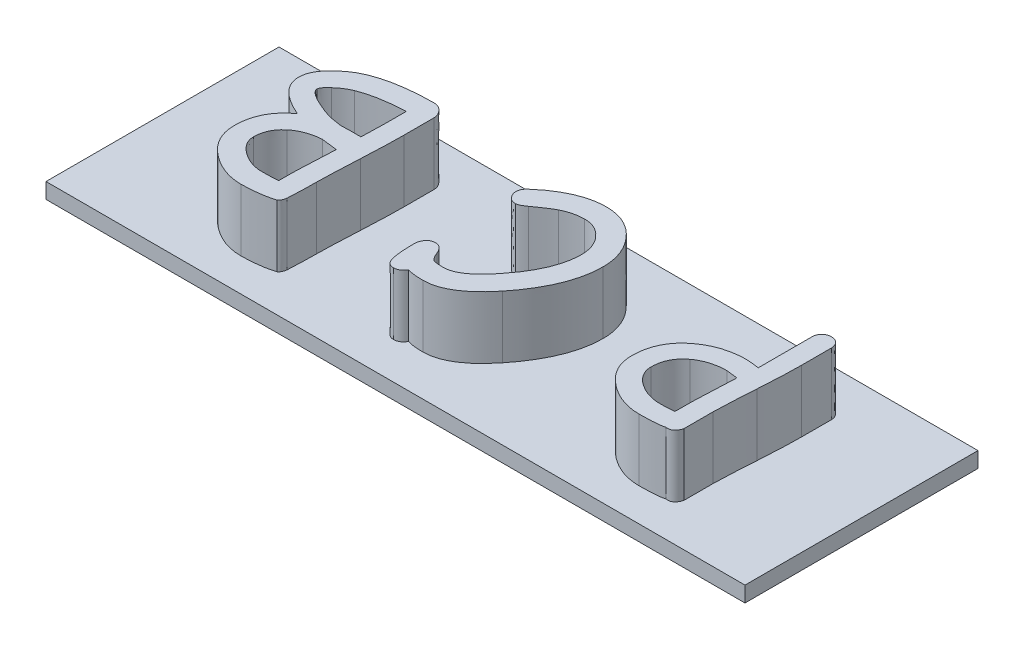
from build123d import *

# Parameters (mm, degrees)
SKETCH1_W           = 114.3
SKETCH1_H           = 38.1
BOSS_EXTRUDE1_DEPTH = 2.54
BOSS_EXTRUDE2_DEPTH = 10.16


with BuildPart() as part:
    # Sketch1 → Boss-Extrude1 (new body)
    with BuildSketch(Plane(origin=(0, 0, 0), x_dir=(1, 0, 0), z_dir=(0, 1, 0))):
        with Locations((57.15, 19.05)):
            Rectangle(SKETCH1_W, SKETCH1_H)
    extrude(amount=BOSS_EXTRUDE1_DEPTH)

    # Sketch2 → Boss-Extrude2 (add)
    # profile 1 of 3: a face of its own
    with BuildSketch(Plane(origin=(0, 2.54, 0), x_dir=(1, 0, 0), z_dir=(0, 1, 0))):
        with BuildLine():
            add(Edge.make_bspline(
                [(92.71, 21.9075), (92.812573831, 21.903302607), (93.064457549, 21.892995349), (93.511163416, 21.850071997), (94.096176455, 21.778624785), (94.532369983, 21.721068917), (94.77375, 21.68921875)],
                knots=[0, 0, 0, 0, 0.593305599, 1.456941008, 2.592726431, 4, 4, 4, 4], degree=3))
            add(Edge.make_bspline(
                [(94.77375, 21.68921875), (94.77375, 21.919075521), (94.77375, 22.416822917), (94.77375, 23.222148438), (94.77375, 24.144882812), (94.77375, 25.186679687), (94.77375, 26.345885417), (94.77375, 27.6225), (94.77375, 29.016523438), (94.77375, 29.985559896), (94.77375, 30.489921875)],
                knots=[0, 0, 0, 0, 0.626832018, 1.357384442, 2.196166855, 3.143179256, 4.198421646, 5.357384442, 6.624577227, 8, 8, 8, 8], degree=3))
            add(Edge.make_bspline(
                [(94.77375, 30.489921875), (94.779741605, 30.596279971), (94.791545965, 30.805821358), (94.876365048, 31.105538766), (95.02132653, 31.378231569), (95.217431277, 31.616997773), (95.455809639, 31.816971191), (95.728442912, 31.964590533), (96.032104414, 32.050092948), (96.243312646, 32.061609989), (96.351328125, 32.0675)],
                knots=[0, 0, 0, 0, 1.025920981, 2.021218054, 2.977888513, 3.987415727, 4.984630399, 5.962890527, 6.9581876, 8, 8, 8, 8], degree=3))
            add(Edge.make_bspline(
                [(96.351328125, 32.0675), (96.462632522, 32.061677106), (96.678716152, 32.050372681), (96.987744688, 31.965663102), (97.263880919, 31.815844739), (97.503123899, 31.613486258), (97.702968147, 31.372581245), (97.843764065, 31.097907127), (97.932324932, 30.797944901), (97.943164423, 30.588121667), (97.94875, 30.48)],
                knots=[0, 0, 0, 0, 1.062403609, 2.062524345, 3.030581152, 4.039640583, 5.038638359, 5.999323576, 6.969053775, 8, 8, 8, 8], degree=3))
            Line((97.94875, 30.48), (97.94875, 25.563710938))
            add(Edge.make_bspline(
                [(97.94875, 25.563710938), (97.947783553, 25.348727469), (97.945753812, 24.897217149), (97.928273239, 24.187847275), (97.909941114, 23.41550699), (97.881017207, 22.580240931), (97.833390457, 21.684232222), (97.783746648, 20.725129876), (97.732015848, 19.702807017), (97.685164864, 19.000331621), (97.661015625, 18.638242188)],
                knots=[0, 0, 0, 0, 0.744252416, 1.563085986, 2.456455997, 3.418843846, 4.456321737, 5.562699762, 6.74369883, 8, 8, 8, 8], degree=3))
            add(Edge.make_bspline(
                [(97.661015625, 18.638242188), (97.635700823, 18.249666229), (97.587015874, 17.502364297), (97.524861035, 16.422296424), (97.461117508, 15.428863267), (97.420532796, 14.520618765), (97.377234296, 13.698989472), (97.350818835, 12.962913725), (97.321113031, 12.31160321), (97.316087631, 11.906277177), (97.31375, 11.717734375)],
                knots=[0, 0, 0, 0, 1.348601287, 2.593604475, 3.746796013, 4.796117256, 5.742194519, 6.596220126, 7.347013097, 8, 8, 8, 8], degree=3))
            Line((97.31375, 11.717734375), (97.31375, 9.410898438))
            add(Edge.make_bspline(
                [(97.31375, 9.410898438), (97.31375, 9.152929688), (97.31375, 8.676679688), (97.31375, 8.018528646), (97.31375, 7.474479167), (97.31375, 7.148710938), (97.31375, 7.00484375)],
                knots=[0, 0, 0, 0, 1.286597938, 2.375257732, 3.282474227, 4, 4, 4, 4], degree=3))
            add(Edge.make_bspline(
                [(97.31375, 7.00484375), (97.278674651, 6.88969175), (97.212539869, 6.672571956), (97.072950348, 6.378332595), (96.902936303, 6.137171168), (96.708061184, 5.941715928), (96.478159361, 5.803348766), (96.219357468, 5.725971133), (95.934534737, 5.693540165), (95.739374789, 5.717374397), (95.636953125, 5.729882813)],
                knots=[0, 0, 0, 0, 1.225321951, 2.310351965, 3.301321782, 4.218671067, 5.102777083, 6.003264188, 6.95209541, 8, 8, 8, 8], degree=3))
            add(Edge.make_bspline(
                [(95.636953125, 5.729882813), (95.536304333, 5.704147637), (95.316559817, 5.647960537), (94.954292598, 5.578281556), (94.53277001, 5.529102638), (94.057024092, 5.47555926), (93.52371498, 5.446166137), (92.933619002, 5.412631581), (92.283402632, 5.400665397), (91.83025759, 5.398585415), (91.593789062, 5.3975)],
                knots=[0, 0, 0, 0, 0.613005048, 1.338361789, 2.174755912, 3.116646051, 4.163043477, 5.325786659, 6.604492527, 8, 8, 8, 8], degree=3))
            add(Edge.make_bspline(
                [(91.593789062, 5.3975), (91.333908942, 5.404965329), (90.81743668, 5.419801537), (90.049935572, 5.514781163), (89.295900264, 5.678990368), (88.556342835, 5.916333437), (87.822401331, 6.20752647), (87.104113633, 6.57272327), (86.395900422, 6.998315616), (85.947386542, 7.328572464), (85.720039062, 7.495976563)],
                knots=[0, 0, 0, 0, 0.981821635, 1.951221358, 2.916849201, 3.892929606, 4.882512172, 5.89671537, 6.933864748, 8, 8, 8, 8], degree=3))
            add(Edge.make_bspline(
                [(85.720039062, 7.495976563), (85.481111422, 7.68811438), (85.01420206, 8.063587665), (84.400425493, 8.690342374), (83.87506742, 9.344196187), (83.454228379, 10.033292306), (83.113551386, 10.745800339), (82.88300534, 11.494895322), (82.731137851, 12.27049905), (82.716252611, 12.800149523), (82.70875, 13.067109375)],
                knots=[0, 0, 0, 0, 1.11821384, 2.185199293, 3.19473146, 4.172962323, 5.126088507, 6.069070675, 7.026753238, 8, 8, 8, 8], degree=3))
            add(Edge.make_bspline(
                [(82.70875, 13.067109375), (82.717872611, 13.405023964), (82.735763235, 14.067718294), (82.888182751, 15.034570075), (83.13489241, 15.949191883), (83.485723933, 16.810027136), (83.93401862, 17.61894464), (84.485282666, 18.372112614), (85.13397576, 19.074350111), (85.630661191, 19.485445795), (85.88375, 19.694921875)],
                knots=[0, 0, 0, 0, 1.062640722, 2.083976256, 3.070982761, 4.037131393, 5.00131682, 5.973289506, 6.967278458, 8, 8, 8, 8], degree=3))
            add(Edge.make_bspline(
                [(85.88375, 19.694921875), (86.123510589, 19.873518068), (86.600007791, 20.228457914), (87.372357216, 20.671789023), (88.173043279, 21.058212957), (89.011723132, 21.370452631), (89.887527655, 21.608096057), (90.796143077, 21.781557167), (91.741727059, 21.88826706), (92.383952328, 21.90102367), (92.71, 21.9075)],
                knots=[0, 0, 0, 0, 0.980516566, 1.948666387, 2.917333375, 3.896286309, 4.881224669, 5.89250628, 6.930058574, 8, 8, 8, 8], degree=3))
        make_face()
        with BuildLine():
            add(Edge.make_bspline(
                [(91.85671875, 8.5725), (92.088245948, 8.574690709), (92.523333554, 8.578807506), (93.135730482, 8.601261313), (93.665220145, 8.645206741), (93.990041126, 8.68721375), (94.13875, 8.706445313)],
                knots=[0, 0, 0, 0, 1.214443937, 2.282191934, 3.213556643, 4, 4, 4, 4], degree=3))
            Line((94.13875, 8.706445313), (94.168515625, 11.80703125))
            Line((94.168515625, 11.80703125), (94.45625, 18.51421875))
            Line((94.45625, 18.51421875), (92.640546875, 18.7325))
            add(Edge.make_bspline(
                [(92.640546875, 18.7325), (92.413886751, 18.726897368), (91.967928227, 18.715874073), (91.312100111, 18.653959769), (90.686313754, 18.536816815), (90.085746291, 18.385794957), (89.513780968, 18.180494022), (88.969091871, 17.931454246), (88.446309089, 17.646674302), (88.127088759, 17.414816103), (87.96734375, 17.298789062)],
                knots=[0, 0, 0, 0, 1.093413471, 2.151313819, 3.172871577, 4.161389512, 5.135157218, 6.098878027, 7.048635948, 8, 8, 8, 8], degree=3))
            add(Edge.make_bspline(
                [(87.96734375, 17.298789062), (87.802007344, 17.166882002), (87.475601999, 16.906472509), (87.05050665, 16.458487557), (86.688173459, 15.977967315), (86.39317713, 15.462915184), (86.163880252, 14.912854232), (85.999438768, 14.330181776), (85.904926057, 13.71179476), (85.890931455, 13.289020639), (85.88375, 13.072070313)],
                knots=[0, 0, 0, 0, 1.035286189, 2.043850807, 3.016094581, 3.977816293, 4.94382854, 5.928750352, 6.937119695, 8, 8, 8, 8], degree=3))
            add(Edge.make_bspline(
                [(85.88375, 13.072070313), (85.888898058, 12.916121842), (85.899073516, 12.607879929), (85.998125081, 12.155040427), (86.157309711, 11.721196819), (86.381657383, 11.305263204), (86.658343337, 10.898763067), (87.012476759, 10.519542564), (87.418271721, 10.14906943), (87.725064935, 9.930314458), (87.883007812, 9.817695313)],
                knots=[0, 0, 0, 0, 0.938388107, 1.854782823, 2.778298207, 3.714197428, 4.695245811, 5.731976383, 6.832379074, 8, 8, 8, 8], degree=3))
            add(Edge.make_bspline(
                [(87.883007812, 9.817695313), (88.0369858, 9.717671517), (88.341784084, 9.519675156), (88.819326108, 9.268913027), (89.30232337, 9.052297167), (89.796104844, 8.880494207), (90.296845959, 8.737273937), (90.81084117, 8.647211347), (91.330918521, 8.58345921), (91.681235867, 8.576157575), (91.85671875, 8.5725)],
                knots=[0, 0, 0, 0, 1.041958917, 2.062549938, 3.058709131, 4.044550683, 5.028557611, 6.011892478, 7.004106296, 8, 8, 8, 8], degree=3))
        make_face(mode=Mode.SUBTRACT)
    # profile 2 of 3: a face of its own
    with BuildSketch(Plane(origin=(0, 2.54, 0), x_dir=(1, 0, 0), z_dir=(0, 1, 0))):
        with BuildLine():
            add(Edge.make_bspline(
                [(50.666054688, 13.0175), (50.750763032, 13.013937537), (50.915793523, 13.006997075), (51.156698876, 12.944528609), (51.379902532, 12.839828655), (51.586716128, 12.693727369), (51.771164673, 12.503778987), (51.945839952, 12.281222148), (52.100632154, 12.013297871), (52.184610331, 11.816311308), (52.22875, 11.712773438)],
                knots=[0, 0, 0, 0, 0.933712839, 1.819078009, 2.725453192, 3.642061967, 4.597116546, 5.637643057, 6.758324407, 8, 8, 8, 8], degree=3))
            add(Edge.make_bspline(
                [(52.22875, 11.712773438), (52.303900338, 11.544407987), (52.440970542, 11.237318398), (52.660883647, 10.840488048), (52.868783866, 10.541908568), (53.03142515, 10.410428564), (53.101875, 10.353476563)],
                knots=[0, 0, 0, 0, 1.353791631, 2.469243637, 3.336936149, 4, 4, 4, 4], degree=3))
            add(Edge.make_bspline(
                [(53.101875, 10.353476563), (53.182144213, 10.322472417), (53.37996356, 10.246064294), (53.759390611, 10.203558063), (54.259879147, 10.159699977), (54.637862041, 10.15989276), (54.848125, 10.16)],
                knots=[0, 0, 0, 0, 0.582507722, 1.435560332, 2.573462759, 4, 4, 4, 4], degree=3))
            add(Edge.make_bspline(
                [(54.848125, 10.16), (55.05597176, 10.172370005), (55.483457051, 10.197811804), (56.125557872, 10.384822521), (56.782585739, 10.677102865), (57.450094871, 11.091619976), (58.141149551, 11.610650536), (58.83426504, 12.258972417), (59.559255542, 13.007309394), (60.019809808, 13.567886667), (60.260507813, 13.860859375)],
                knots=[0, 0, 0, 0, 0.737623456, 1.517094505, 2.358633461, 3.286443813, 4.301470694, 5.424031612, 6.653729874, 8, 8, 8, 8], degree=3))
            add(Edge.make_bspline(
                [(60.260507813, 13.860859375), (60.581648633, 14.268665509), (61.205062763, 15.060318547), (62.026791469, 16.279774771), (62.719144673, 17.484534622), (63.295791934, 18.670249789), (63.741160277, 19.843911469), (64.055368008, 21.001867269), (64.254300653, 22.143729579), (64.280710769, 22.902230744), (64.29375, 23.27671875)],
                knots=[0, 0, 0, 0, 1.192864529, 2.315646454, 3.376461344, 4.384628161, 5.343364718, 6.257162951, 7.13952463, 8, 8, 8, 8], degree=3))
            add(Edge.make_bspline(
                [(64.29375, 23.27671875), (64.290322878, 23.452188736), (64.283541597, 23.799393032), (64.217954321, 24.311160713), (64.107087834, 24.803296355), (63.961632037, 25.279499755), (63.75658044, 25.729877938), (63.527075963, 26.171520826), (63.242037054, 26.587984351), (63.024306782, 26.847053342), (62.914609375, 26.977578125)],
                knots=[0, 0, 0, 0, 1.041626279, 2.061076808, 3.05693893, 4.035217014, 5.011324213, 5.990981263, 6.987811181, 8, 8, 8, 8], degree=3))
            add(Edge.make_bspline(
                [(62.914609375, 26.977578125), (62.796111992, 27.10383323), (62.562792758, 27.352427279), (62.181594232, 27.679950278), (61.77933027, 27.954928504), (61.363037573, 28.18696451), (60.923341806, 28.35943644), (60.467895093, 28.484766134), (59.995184638, 28.561004642), (59.673741328, 28.570303764), (59.51140625, 28.575)],
                knots=[0, 0, 0, 0, 1.070279958, 2.107362141, 3.100139134, 4.07950068, 5.047963688, 6.013019366, 6.996536412, 8, 8, 8, 8], degree=3))
            add(Edge.make_bspline(
                [(59.51140625, 28.575), (59.224475705, 28.56459621), (58.6460298, 28.543622391), (57.781788664, 28.367287817), (56.91075503, 28.105610746), (56.353297837, 27.841671676), (56.068515625, 27.706835937)],
                knots=[0, 0, 0, 0, 0.960475423, 1.936298118, 2.945738628, 4, 4, 4, 4], degree=3))
            add(Edge.make_bspline(
                [(56.068515625, 27.706835937), (55.982339157, 27.660880425), (55.798792323, 27.563000005), (55.50796712, 27.398153425), (55.188032453, 27.19962515), (54.834962461, 26.970065161), (54.450337609, 26.71270062), (54.030148154, 26.42921781), (53.581037848, 26.112272967), (53.271945024, 25.888178728), (53.111796875, 25.772070312)],
                knots=[0, 0, 0, 0, 0.662804741, 1.411704544, 2.268239976, 3.217669815, 4.269734379, 5.408990489, 6.657537973, 8, 8, 8, 8], degree=3))
            add(Edge.make_bspline(
                [(53.111796875, 25.772070312), (52.964690943, 25.66838422), (52.698258472, 25.480592051), (52.311454154, 25.262057303), (51.981816772, 25.11989388), (51.773233951, 25.093787766), (51.683046875, 25.0825)],
                knots=[0, 0, 0, 0, 1.344225989, 2.434609181, 3.323156051, 4, 4, 4, 4], degree=3))
            add(Edge.make_bspline(
                [(51.683046875, 25.0825), (51.568157647, 25.089104477), (51.343772535, 25.102003393), (51.021502689, 25.206424168), (50.728557243, 25.377009574), (50.47857254, 25.617637284), (50.27675253, 25.896266397), (50.114884795, 26.192043446), (50.023508986, 26.510887088), (50.012024814, 26.728995897), (50.00625, 26.838671875)],
                knots=[0, 0, 0, 0, 1.023747098, 1.999435557, 2.991841515, 4.025648951, 5.070775783, 6.054581683, 7.021746723, 8, 8, 8, 8], degree=3))
            add(Edge.make_bspline(
                [(50.00625, 26.838671875), (50.013735386, 26.960417644), (50.028667193, 27.203275438), (50.155184235, 27.552628717), (50.35845789, 27.878998411), (50.544389064, 28.062622297), (50.64125, 28.15828125)],
                knots=[0, 0, 0, 0, 0.966159961, 1.927290611, 2.92022103, 4, 4, 4, 4], degree=3))
            add(Edge.make_bspline(
                [(50.64125, 28.15828125), (51.007304009, 28.469661418), (51.720204433, 29.076083008), (52.836382909, 29.872871949), (53.955139086, 30.545030634), (55.074283337, 31.102514176), (56.201331891, 31.531604646), (57.33040284, 31.841075133), (58.464626875, 32.033959481), (59.222937649, 32.056347183), (59.600703125, 32.0675)],
                knots=[0, 0, 0, 0, 1.153702793, 2.246868467, 3.288879027, 4.285211342, 5.245483025, 6.179961226, 7.093316569, 8, 8, 8, 8], degree=3))
            add(Edge.make_bspline(
                [(59.600703125, 32.0675), (59.885680746, 32.061138771), (60.445477641, 32.048643066), (61.266401412, 31.912175408), (62.054056678, 31.703867203), (62.813125866, 31.418979922), (63.530866785, 31.034063752), (64.219077607, 30.576674966), (64.874263375, 30.034001099), (65.268672347, 29.616204566), (65.469492188, 29.403476562)],
                knots=[0, 0, 0, 0, 1.02775266, 2.01886993, 2.994699873, 3.965771962, 4.937650864, 5.927617177, 6.944812066, 8, 8, 8, 8], degree=3))
            add(Edge.make_bspline(
                [(65.469492188, 29.403476562), (65.653921928, 29.186785738), (66.018923992, 28.75793626), (66.488933153, 28.063069197), (66.895896316, 27.344149866), (67.217539932, 26.588751912), (67.471088649, 25.80831024), (67.656372699, 24.998621852), (67.767688782, 24.159589617), (67.780018618, 23.589593893), (67.78625, 23.301523437)],
                knots=[0, 0, 0, 0, 1.021574095, 2.02178158, 3.008489412, 3.985130734, 4.965811059, 5.953001646, 6.965466368, 8, 8, 8, 8], degree=3))
            add(Edge.make_bspline(
                [(67.78625, 23.301523437), (67.771477852, 22.826122533), (67.741621096, 21.865265072), (67.50969293, 20.421857034), (67.128088754, 18.973825462), (66.603309774, 17.515569154), (65.923543794, 16.053291647), (65.099946925, 14.579073617), (64.125803613, 13.097278514), (63.384259076, 12.139529579), (63.00390625, 11.64828125)],
                knots=[0, 0, 0, 0, 0.888406589, 1.795604703, 2.725338484, 3.684575346, 4.688744716, 5.736321835, 6.838914799, 8, 8, 8, 8], degree=3))
            add(Edge.make_bspline(
                [(63.00390625, 11.64828125), (62.677455683, 11.25439244), (62.047933171, 10.494823002), (61.04195109, 9.481697368), (60.041493292, 8.615206935), (59.033822524, 7.907818513), (58.023951142, 7.353594957), (57.006538412, 6.962210996), (55.985982904, 6.71560496), (55.30087612, 6.683412696), (54.962226563, 6.6675)],
                knots=[0, 0, 0, 0, 1.25516882, 2.42044925, 3.499955563, 4.499851551, 5.437013001, 6.319711889, 7.169430459, 8, 8, 8, 8], degree=3))
            add(Edge.make_bspline(
                [(54.962226563, 6.6675), (54.70084229, 6.671412658), (54.205563552, 6.678826481), (53.504217896, 6.730658321), (52.880015041, 6.824499461), (52.49908658, 6.933294277), (52.318046875, 6.985)],
                knots=[0, 0, 0, 0, 1.173265465, 2.223138502, 3.15553046, 4, 4, 4, 4], degree=3))
            add(Edge.make_bspline(
                [(52.318046875, 6.985), (52.218765643, 6.840365498), (52.030647758, 6.566312325), (51.657363223, 6.259886604), (51.237675929, 6.063700786), (50.937714664, 6.043020538), (50.785117188, 6.0325)],
                knots=[0, 0, 0, 0, 1.110080292, 2.103377977, 3.035142967, 4, 4, 4, 4], degree=3))
            add(Edge.make_bspline(
                [(50.785117188, 6.0325), (50.691944586, 6.036771666), (50.512263397, 6.045009473), (50.256625583, 6.122918985), (50.02850637, 6.249736965), (49.826554656, 6.426729552), (49.657455098, 6.656885198), (49.513082891, 6.932500966), (49.400378022, 7.259216389), (49.348848321, 7.495331276), (49.321640625, 7.62)],
                knots=[0, 0, 0, 0, 0.941538656, 1.815735352, 2.677817882, 3.567910365, 4.512422935, 5.553677293, 6.708340948, 8, 8, 8, 8], degree=3))
            add(Edge.make_bspline(
                [(49.321640625, 7.62), (49.278343067, 7.86757307), (49.18722835, 8.388562038), (49.119460547, 9.21659317), (49.057463942, 10.122694207), (49.055023582, 10.753518038), (49.05375, 11.082734375)],
                knots=[0, 0, 0, 0, 0.866772891, 1.824023565, 2.86439453, 4, 4, 4, 4], degree=3))
            add(Edge.make_bspline(
                [(49.05375, 11.082734375), (49.059107693, 11.198766291), (49.069526019, 11.424396648), (49.133710796, 11.753176139), (49.249018259, 12.058630455), (49.357049551, 12.244924665), (49.4109375, 12.337851563)],
                knots=[0, 0, 0, 0, 1.053166987, 2.047940346, 3.026277585, 4, 4, 4, 4], degree=3))
            add(Edge.make_bspline(
                [(49.4109375, 12.337851563), (49.486878172, 12.441836636), (49.634388055, 12.64382097), (49.938242216, 12.86312989), (50.289138052, 12.992133139), (50.537613513, 13.008855782), (50.666054688, 13.0175)],
                knots=[0, 0, 0, 0, 1.031344426, 2.003320372, 2.967882484, 4, 4, 4, 4], degree=3))
        make_face()
    # profile 3 of 3: a face of its own
    with BuildSketch(Plane(origin=(0, 2.54, 0), x_dir=(1, 0, 0), z_dir=(0, 1, 0))):
        with BuildLine():
            add(Edge.make_bspline(
                [(21.361796875, 31.219179688), (21.681241957, 31.338918911), (22.334936721, 31.583946641), (23.364691257, 31.883257052), (24.459896409, 32.13553068), (25.619209269, 32.341353512), (26.842108342, 32.506407744), (28.130176088, 32.617104192), (29.482054647, 32.687998633), (30.405493596, 32.697599244), (30.876875, 32.7025)],
                knots=[0, 0, 0, 0, 0.845151617, 1.729471567, 2.654905988, 3.629126748, 4.646228224, 5.71174863, 6.831932372, 8, 8, 8, 8], degree=3))
            add(Edge.make_bspline(
                [(30.876875, 32.7025), (30.995305598, 32.693098167), (31.233626049, 32.674178655), (31.585267515, 32.54108547), (31.916206104, 32.315035167), (32.229274481, 32.024439773), (32.499641909, 31.691712183), (32.711140368, 31.342559005), (32.837129715, 30.977847047), (32.853298604, 30.730582151), (32.86125, 30.608984375)],
                knots=[0, 0, 0, 0, 0.905992743, 1.823148757, 2.837857722, 3.957674848, 5.082632051, 6.109585782, 7.070348569, 8, 8, 8, 8], degree=3))
            Line((32.86125, 30.608984375), (32.86125, 25.702617188))
            add(Edge.make_bspline(
                [(32.86125, 25.702617188), (32.8598951, 25.490947369), (32.857047587, 25.046093678), (32.846344597, 24.346599862), (32.832550273, 23.582539556), (32.807715326, 22.754010137), (32.769703581, 21.862936758), (32.738254559, 20.906874241), (32.692729054, 19.886577488), (32.656618257, 19.183923904), (32.638007813, 18.821796875)],
                knots=[0, 0, 0, 0, 0.737849974, 1.550694791, 2.438561872, 3.401627494, 4.439981643, 5.54745813, 6.736031923, 8, 8, 8, 8], degree=3))
            add(Edge.make_bspline(
                [(32.638007813, 18.821796875), (32.617669637, 18.433214348), (32.578555635, 17.68589966), (32.52997648, 16.605934178), (32.485560601, 15.60877992), (32.443975042, 14.694448321), (32.416050878, 13.862527454), (32.388921787, 13.115188238), (32.375154748, 12.450327392), (32.368334999, 12.035235889), (32.36515625, 11.841757813)],
                knots=[0, 0, 0, 0, 1.336822694, 2.570952543, 3.714018919, 4.766024101, 5.715397503, 6.573729646, 7.335201894, 8, 8, 8, 8], degree=3))
            add(Edge.make_bspline(
                [(32.36515625, 11.841757813), (32.365465075, 11.704504078), (32.366119954, 11.413451124), (32.360573488, 10.953716572), (32.350617041, 10.447687794), (32.335344846, 9.893714207), (32.315603393, 9.291775187), (32.290636874, 8.641890164), (32.260773581, 7.945702728), (32.23802004, 7.466202037), (32.22625, 7.218164063)],
                knots=[0, 0, 0, 0, 0.712050435, 1.509936202, 2.385154333, 3.337762284, 4.384953036, 5.509609977, 6.711761402, 8, 8, 8, 8], degree=3))
            add(Edge.make_bspline(
                [(32.22625, 7.218164063), (32.204247635, 7.087972578), (32.163616178, 6.847549802), (32.043080791, 6.528701551), (31.888741545, 6.270541388), (31.740651221, 6.159446544), (31.670625, 6.106914063)],
                knots=[0, 0, 0, 0, 1.23418656, 2.279154888, 3.186278501, 4, 4, 4, 4], degree=3))
            add(Edge.make_bspline(
                [(31.670625, 6.106914063), (31.277130165, 5.99523327), (30.473234716, 5.767073527), (29.204109687, 5.560699618), (27.86216282, 5.420489115), (26.939946742, 5.405297427), (26.466601563, 5.3975)],
                knots=[0, 0, 0, 0, 0.930556381, 1.901092399, 2.922695212, 4, 4, 4, 4], degree=3))
            add(Edge.make_bspline(
                [(26.466601563, 5.3975), (26.219791811, 5.402088691), (25.727440862, 5.411242488), (24.995525835, 5.520604357), (24.267800916, 5.667389331), (23.552111049, 5.89804755), (22.838558911, 6.176636604), (22.141546294, 6.537026874), (21.440011022, 6.938401944), (20.996920648, 7.258615482), (20.771445313, 7.4215625)],
                knots=[0, 0, 0, 0, 0.962255807, 1.919565813, 2.882686686, 3.856213935, 4.849577646, 5.868271975, 6.915227863, 8, 8, 8, 8], degree=3))
            add(Edge.make_bspline(
                [(20.771445313, 7.4215625), (20.521029366, 7.616902097), (20.034441312, 7.996470233), (19.388248172, 8.631479972), (18.84484326, 9.302982054), (18.39715345, 10.009825596), (18.046073251, 10.750237546), (17.804296742, 11.528910663), (17.6482623, 12.338231286), (17.630335336, 12.891097825), (17.62125, 13.171289063)],
                knots=[0, 0, 0, 0, 1.117202605, 2.170857918, 3.180777677, 4.15128398, 5.109476991, 6.055661985, 7.014614856, 8, 8, 8, 8], degree=3))
            add(Edge.make_bspline(
                [(17.62125, 13.171289063), (17.631192696, 13.52418398), (17.650630894, 14.214101598), (17.818455076, 15.218425232), (18.091193818, 16.165174472), (18.476703924, 17.055076899), (18.968813882, 17.889286385), (19.579042615, 18.658221181), (20.291171951, 19.375501512), (20.83557696, 19.790466533), (21.11375, 20.0025)],
                knots=[0, 0, 0, 0, 1.058953792, 2.070278829, 3.047589135, 4.010504305, 4.974404593, 5.94679655, 6.95088062, 8, 8, 8, 8], degree=3))
            add(Edge.make_bspline(
                [(21.11375, 20.0025), (20.907988313, 20.091895468), (20.50481403, 20.267059047), (19.927633335, 20.54918234), (19.388444148, 20.836511519), (18.892866434, 21.134644043), (18.435564091, 21.436937455), (18.016333702, 21.744187296), (17.637836003, 22.061767789), (17.300706631, 22.389402088), (17.000187603, 22.722536884), (16.741078048, 23.063450738), (16.527873875, 23.414645559), (16.345640162, 23.767648049), (16.206051362, 24.132014356), (16.107356609, 24.504551647), (16.045114454, 24.883631562), (16.037540811, 25.138490813), (16.03375, 25.266054688)],
                knots=[0, 0, 0, 0, 1.38962609, 2.722866017, 3.978687303, 5.173353845, 6.304164816, 7.373688721, 8.391529438, 9.362297355, 10.283647407, 11.168747024, 12.010330037, 12.825820902, 13.626769129, 14.421931413, 15.210134443, 16, 16, 16, 16], degree=3))
            add(Edge.make_bspline(
                [(16.03375, 25.266054688), (16.041022348, 25.435154869), (16.055688133, 25.776170887), (16.157263493, 26.28397829), (16.329918291, 26.786303446), (16.569715364, 27.284118117), (16.880880496, 27.775660355), (17.257195464, 28.264289319), (17.696967478, 28.75057697), (18.03030637, 29.05400447), (18.201679688, 29.21)],
                knots=[0, 0, 0, 0, 0.874407195, 1.76337398, 2.666706198, 3.61537891, 4.614412331, 5.66984113, 6.80203881, 8, 8, 8, 8], degree=3))
            add(Edge.make_bspline(
                [(18.201679688, 29.21), (18.4509263, 29.424842246), (18.941495549, 29.847696536), (19.729604162, 30.388656352), (20.527583243, 30.861182308), (21.086100842, 31.10086652), (21.361796875, 31.219179688)],
                knots=[0, 0, 0, 0, 1.04855267, 2.063770054, 3.044236175, 4, 4, 4, 4], degree=3))
        make_face()
        with BuildLine():
            add(Edge.make_bspline(
                [(26.421953125, 8.89), (26.711391967, 8.889487487), (27.242443117, 8.888547147), (27.969945899, 8.917255471), (28.558152594, 8.943808395), (28.902565765, 8.985921294), (29.05125, 9.004101563)],
                knots=[0, 0, 0, 0, 1.318666403, 2.419437924, 3.317666446, 4, 4, 4, 4], degree=3))
            Line((29.05125, 9.004101563), (29.081015625, 11.836796875))
            Line((29.081015625, 11.836796875), (29.36875, 18.0975))
            add(Edge.make_bspline(
                [(29.36875, 18.0975), (29.178636845, 18.12437163), (28.821783423, 18.17481124), (28.320511465, 18.239419837), (27.88981509, 18.289857548), (27.530856958, 18.346751005), (27.240250631, 18.371834051), (27.02226026, 18.395965377), (26.875403409, 18.416918876), (26.800662983, 18.415502038), (26.774179688, 18.415)],
                knots=[0, 0, 0, 0, 1.762322086, 3.307980804, 4.639009442, 5.742339968, 6.642480699, 7.314625783, 7.757146586, 8, 8, 8, 8], degree=3))
            add(Edge.make_bspline(
                [(26.774179688, 18.415), (26.563898932, 18.394063513), (26.151776293, 18.35303075), (25.549402658, 18.255022731), (24.976547363, 18.117385196), (24.435266113, 17.934476701), (23.916989747, 17.731826977), (23.434143616, 17.477897121), (22.975376331, 17.200159478), (22.695921285, 16.980863397), (22.557382813, 16.872148438)],
                knots=[0, 0, 0, 0, 1.111668853, 2.178724819, 3.208523688, 4.207274432, 5.183138131, 6.132619595, 7.074255292, 8, 8, 8, 8], degree=3))
            add(Edge.make_bspline(
                [(22.557382813, 16.872148438), (22.417096267, 16.749580598), (22.140780305, 16.508164355), (21.78424896, 16.097491074), (21.478541034, 15.664334783), (21.228821349, 15.204800106), (21.033484242, 14.718923725), (20.893974467, 14.206403364), (20.815286099, 13.666501424), (20.80267065, 13.298866225), (20.79625, 13.111757813)],
                knots=[0, 0, 0, 0, 1.039321603, 2.047104005, 3.028387125, 3.995399141, 4.960910613, 5.946659751, 6.95494981, 8, 8, 8, 8], degree=3))
            add(Edge.make_bspline(
                [(20.79625, 13.111757813), (20.802343143, 12.982312311), (20.81457802, 12.722389016), (20.902962438, 12.338419468), (21.041714404, 11.961480406), (21.245878078, 11.597531852), (21.500800162, 11.237381594), (21.815052064, 10.886309453), (22.185980966, 10.54392152), (22.601528869, 10.211521298), (23.049249585, 9.904680334), (23.512774324, 9.636102447), (23.981223324, 9.405605406), (24.455415509, 9.217379766), (24.938315474, 9.070898065), (25.426531546, 8.969373302), (25.922216115, 8.899717123), (26.254696081, 8.893252225), (26.421953125, 8.89)],
                knots=[0, 0, 0, 0, 0.811242333, 1.62895411, 2.459129834, 3.322327336, 4.237291748, 5.22161397, 6.27082113, 7.399617863, 8.555897456, 9.671084493, 10.756314045, 11.826978775, 12.866920777, 13.916384135, 14.951818258, 16, 16, 16, 16], degree=3))
        make_face(mode=Mode.SUBTRACT)
        with BuildLine():
            Line((24.516953125, 22.150585938), (26.302890625, 21.857890625))
            add(Edge.make_bspline(
                [(26.302890625, 21.857890625), (26.395517328, 21.858894878), (26.61730874, 21.861299527), (26.969300223, 21.88288043), (27.324619508, 21.90419768), (27.551370537, 21.906518222), (27.647304688, 21.9075)],
                knots=[0, 0, 0, 0, 0.826025671, 1.977889664, 3.144482654, 4, 4, 4, 4], degree=3))
            add(Edge.make_bspline(
                [(27.647304688, 21.9075), (27.961497396, 21.9075), (28.608072917, 21.9075), (29.254648438, 21.9075), (29.58703125, 21.9075)],
                knots=[0, 0, 0, 0, 0.971867008, 2, 2, 2, 2], degree=3))
            add(Edge.make_bspline(
                [(29.58703125, 21.9075), (29.602986647, 22.253072495), (29.633974383, 22.924225313), (29.661456873, 23.9033588), (29.684467414, 24.826076513), (29.685668042, 25.423137235), (29.68625, 25.712539063)],
                knots=[0, 0, 0, 0, 1.090500536, 2.117913084, 3.087731999, 4, 4, 4, 4], degree=3))
            Line((29.68625, 25.712539063), (29.68625, 29.21))
            add(Edge.make_bspline(
                [(29.68625, 29.21), (29.327266443, 29.194189951), (28.625130076, 29.163267056), (27.597700514, 29.077849183), (26.621136241, 28.96579608), (25.694697118, 28.820429775), (24.818916085, 28.652545095), (23.996957121, 28.43784859), (23.221252927, 28.213427725), (22.73146482, 28.022888945), (22.492890625, 27.930078125)],
                knots=[0, 0, 0, 0, 1.174554609, 2.297312758, 3.369479548, 4.38709733, 5.362442624, 6.282834613, 7.163574323, 8, 8, 8, 8], degree=3))
            add(Edge.make_bspline(
                [(22.492890625, 27.930078125), (22.295832737, 27.846412195), (21.896785389, 27.676986512), (21.324240116, 27.343900054), (20.765829339, 26.945221315), (20.415045787, 26.638390033), (20.235664063, 26.481484375)],
                knots=[0, 0, 0, 0, 0.951791991, 1.927403529, 2.940127251, 4, 4, 4, 4], degree=3))
            add(Edge.make_bspline(
                [(20.235664063, 26.481484375), (20.081571302, 26.344112687), (19.807342581, 26.099641355), (19.488123491, 25.734061762), (19.264472899, 25.430012915), (19.225179205, 25.2234408), (19.20875, 25.137070313)],
                knots=[0, 0, 0, 0, 1.433431585, 2.550983634, 3.394147416, 4, 4, 4, 4], degree=3))
            add(Edge.make_bspline(
                [(19.20875, 25.137070313), (19.216461359, 25.06660476), (19.232761405, 24.917656734), (19.342927896, 24.698640328), (19.516738456, 24.479067941), (19.760883202, 24.25832809), (20.064567541, 24.023832389), (20.438730574, 23.789080923), (20.878120669, 23.545165294), (21.197281855, 23.389267024), (21.366757813, 23.306484375)],
                knots=[0, 0, 0, 0, 0.575185487, 1.215810285, 1.966963897, 2.855761369, 3.896008111, 5.098876818, 6.459491156, 8, 8, 8, 8], degree=3))
            add(Edge.make_bspline(
                [(21.366757813, 23.306484375), (21.633629775, 23.183437845), (22.159319454, 22.941058353), (22.951354688, 22.62390022), (23.734134163, 22.356372183), (24.258086077, 22.218636509), (24.516953125, 22.150585938)],
                knots=[0, 0, 0, 0, 1.049024965, 2.066390161, 3.044668301, 4, 4, 4, 4], degree=3))
        make_face(mode=Mode.SUBTRACT)
    extrude(amount=BOSS_EXTRUDE2_DEPTH)


solid = part.part
